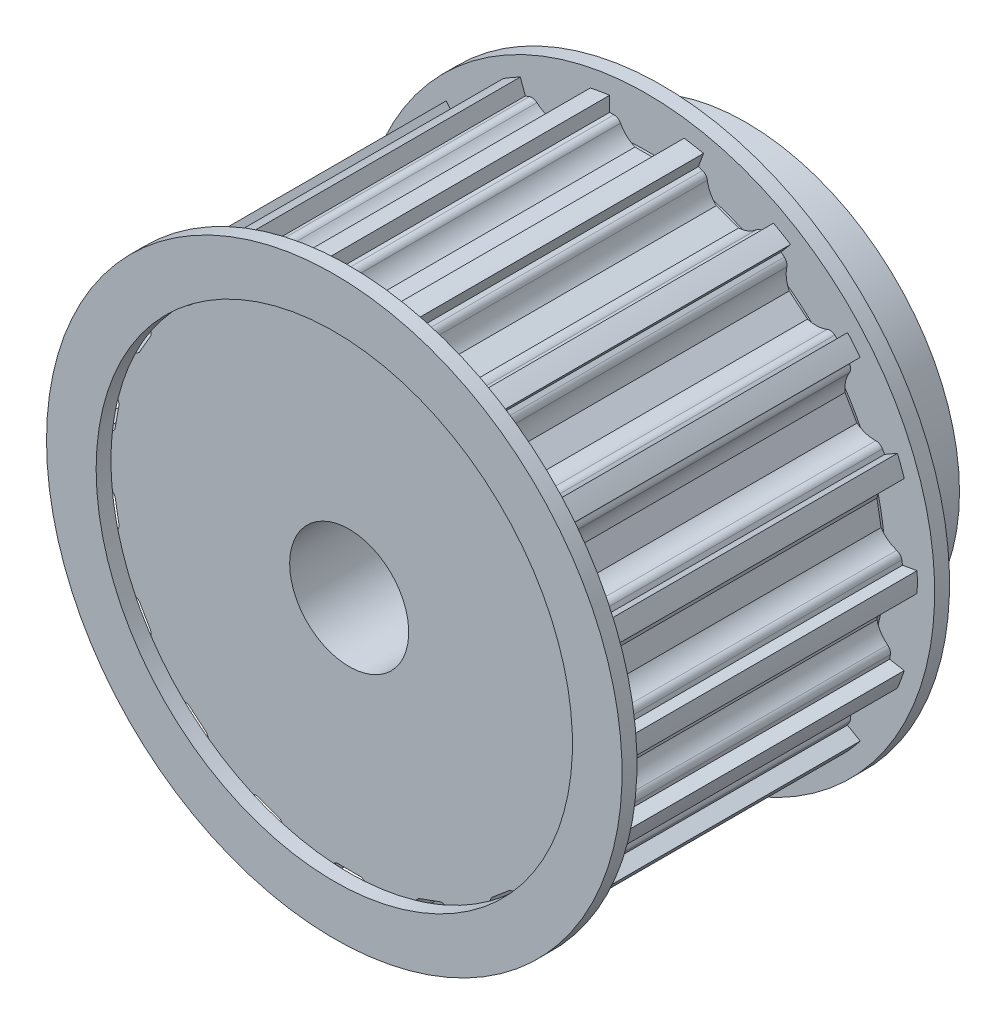
from build123d import *

# Parameters (mm, degrees)
CUT_EXTRUDE1_DEPTH = 56.543901555
CIRPATTERN1_COUNT  = 18
SKETCH3_W          = 1.5
SKETCH3_H          = 5


with BuildPart() as part:
    # Sketch1 → Revolve1 (revolve)
    with BuildSketch(Plane(origin=(0, 0, 0), x_dir=(0, 0, -1), z_dir=(1, 0, 0)), mode=Mode.PRIVATE) as revolve1_sk:
        Polygon((0, 6), (0, 27.25), (30, 27.25), (30, 21.5), (40, 21.5), (40, 6), align=None)
    revolve(revolve1_sk.sketch.rotate(Axis((0, 0, -88.99), (0, 0, 1)), 90), axis=Axis((0, 0, -88.99), (0, 0, 1)))

    # Sketch2 → Cut-Extrude1 (cut, through all)
    with BuildSketch(Plane.XY):
        with BuildLine():
            Line((3.31662479, 25.5), (3.75, 25.5))
            Line((3.75, 25.5), (3.75, 27.5))
            Line((3.75, 27.5), (-3.75, 27.5))
            Line((-3.75, 27.5), (-3.75, 25.5))
            Line((-3.75, 25.5), (-3.31662479, 25.5))
            ThreePointArc((-3.31662479, 25.5), (-2.929326456, 25.392261629), (-2.653299832, 25.1))
            ThreePointArc((-2.653299832, 25.1), (-2.040979513, 24.301272498), (-1.198957881, 23.75))
            Line((-1.198957881, 23.75), (1.198957881, 23.75))
            ThreePointArc((1.198957881, 23.75), (2.040979513, 24.301272498), (2.653299832, 25.1))
            ThreePointArc((2.653299832, 25.1), (2.929326456, 25.392261629), (3.31662479, 25.5))
        make_face()
    cut_extrude1 = extrude(amount=-CUT_EXTRUDE1_DEPTH, mode=Mode.SUBTRACT)

    # CirPattern1: Cut-Extrude1 ×18 about axis
    cirpattern1_axis = Axis((0, 0, 0), (0, 0, 1))
    for i in range(1, CIRPATTERN1_COUNT):
        add(cut_extrude1.rotate(cirpattern1_axis, i * 360 / CIRPATTERN1_COUNT), mode=Mode.SUBTRACT)

    # Sketch3 → Revolve2 (revolve)
    with BuildSketch(Plane(origin=(0, 0, 0), x_dir=(0, 0, -1), z_dir=(1, 0, 0)), mode=Mode.PRIVATE) as revolve2_sk:
        with Locations((-0.75, 26.5)):
            Rectangle(SKETCH3_W, SKETCH3_H)
        with Locations((30.75, 26.5)):
            Rectangle(SKETCH3_W, SKETCH3_H)
    revolve(revolve2_sk.sketch.rotate(Axis((0, 0, -88.99), (0, 0, 1)), 90), axis=Axis((0, 0, -88.99), (0, 0, 1)))


solid = part.part
